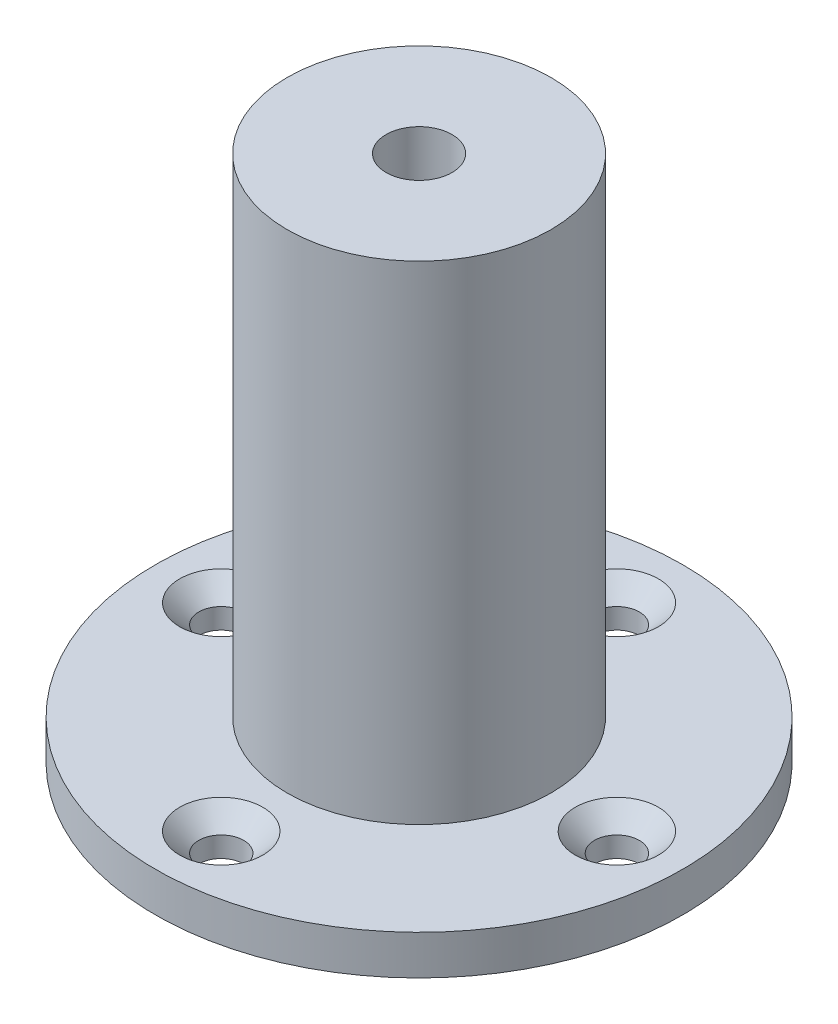
from build123d import *

# Parameters (mm, degrees)
SKETCH1_R             = 10
BOSS_EXTRUDE1_DEPTH   = 40
SKETCH2_R             = 20
BOSS_EXTRUDE2_DEPTH   = 3
CIRPATTERN1_COUNT     = 4
M6_TAPPED_HOLE1_D     = 5
M6_TAPPED_HOLE1_DEPTH = 17
M6_TAPPED_HOLE1_TIP   = 1.502151548


with BuildPart() as part:
    # Sketch1 → Boss-Extrude1 (new body)
    with BuildSketch(Plane(origin=(0, 0, 0), x_dir=(1, 0, 0), z_dir=(0, 1, 0))):
        with Locations(Location((0, 0, 0), (0, 0, 270))):
            Circle(SKETCH1_R)
    extrude(amount=BOSS_EXTRUDE1_DEPTH)

    # Sketch2 → Boss-Extrude2 (add)
    with BuildSketch(Plane.XZ):
        with Locations(Location((0, 0, 0), (0, 0, 270))):
            Circle(SKETCH2_R)
    extrude(amount=-BOSS_EXTRUDE2_DEPTH)

    # Sketch3 → CSK for M3 Countersunk Flat Head Screw1 (revolve, cut)
    with BuildSketch(Plane(origin=(0, 3, -15), x_dir=(0, 0, 1), z_dir=(1, 0, 0))):
        Polygon((0, 0), (0, 3), (1.7, 3), (1.7, 1.45), (3.15, 0), align=None)
    csk_for_m3_countersunk_flat_head_screw1 = revolve(axis=Axis((0, 9.35, -15), (0, -1, 0)), mode=Mode.SUBTRACT)

    # CirPattern1: CSK for M3 Countersunk Flat Head Screw1 ×4 about axis
    cirpattern1_axis = Axis((0, 0, 0), (0, 1, 0))
    for i in range(1, CIRPATTERN1_COUNT):
        add(csk_for_m3_countersunk_flat_head_screw1.rotate(cirpattern1_axis, i * 360 / CIRPATTERN1_COUNT), mode=Mode.SUBTRACT)

    # M6 Tapped Hole1
    with Locations(Plane(origin=(0, 40, 0), x_dir=(1, 0, 0), z_dir=(0, 1, 0))):
        with Locations((0, 0)):
            Hole(M6_TAPPED_HOLE1_D / 2, depth=M6_TAPPED_HOLE1_DEPTH)
            with Locations((0, 0, -(M6_TAPPED_HOLE1_DEPTH + M6_TAPPED_HOLE1_TIP / 2))):  # 118° drill point
                Cone(0, M6_TAPPED_HOLE1_D / 2, M6_TAPPED_HOLE1_TIP, mode=Mode.SUBTRACT)


solid = part.part
